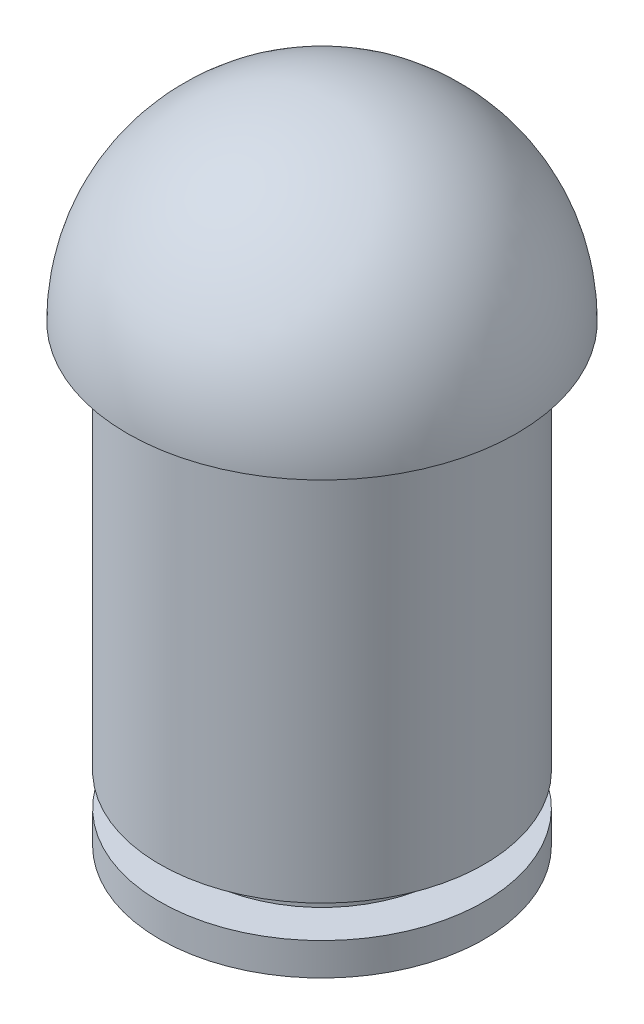
from build123d import *

# Parameters (mm, degrees)
SKETCH1_R           = 2.5
BOSS_EXTRUDE1_DEPTH = 7
SKETCH3_W           = 0.625
SKETCH3_H           = 0.5


with BuildPart() as part:
    # Sketch1 → Boss-Extrude1 (new body)
    with BuildSketch(Plane(origin=(0, 0, 0), x_dir=(1, 0, 0), z_dir=(0, 1, 0))):
        with Locations(Location((0, 0, 0), (0, 0, 270))):
            Circle(SKETCH1_R)
    extrude(amount=BOSS_EXTRUDE1_DEPTH)

    # Sketch2 → Revolve1 (revolve)
    with BuildSketch(Plane.XY):
        with BuildLine():
            Line((0, 7), (3, 7))
            ThreePointArc((3, 7), (2.121320344, 9.121320344), (0, 10))
            Line((0, 10), (0, 7))
        make_face()
    revolve(axis=Axis((0, 7, 0), (0, 1, 0)))

    # Sketch3 → Cut-Revolve1 (revolve, cut)
    with BuildSketch(Plane.XY, mode=Mode.PRIVATE) as cut_revolve1_sk:
        with Locations((2.1875, 0.75)):
            Rectangle(SKETCH3_W, SKETCH3_H)
    revolve(cut_revolve1_sk.sketch.rotate(Axis((0, 7, 0), (0, -1, 0)), 180), axis=Axis((0, 7, 0), (0, -1, 0)), mode=Mode.SUBTRACT)


solid = part.part
